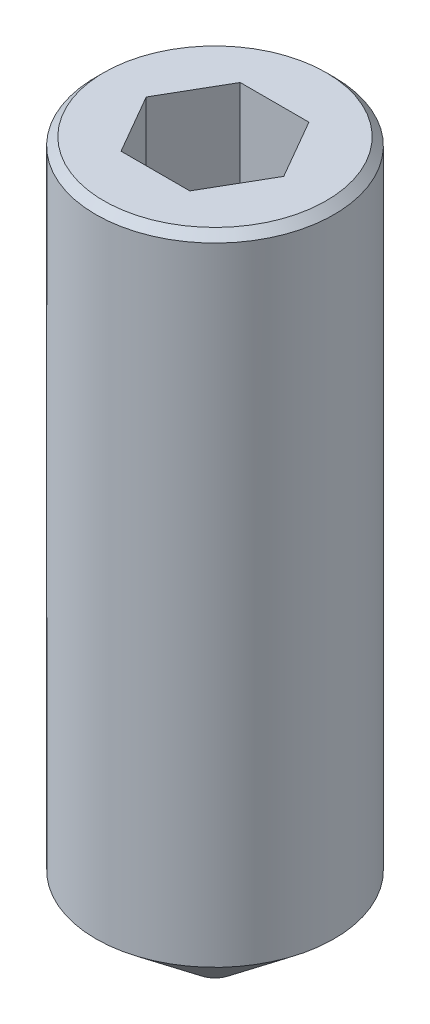
from build123d import *

# Parameters (mm, degrees)
CUT_EXTRUDE_1_DEPTH = 1.5
CHAMFER_1_SIZE      = 0.1


with BuildPart() as part:
    # 草图1 → 旋转1 (revolve)
    with BuildSketch(Plane.XY, mode=Mode.PRIVATE) as revolve_1_sk:
        Polygon((0, 0), (1.5, 0), (1.5, -8), (0.25, -9), (0, -9), align=None)
    revolve(revolve_1_sk.sketch.rotate(Axis((0, 8.713500289, 0), (0, -1, 0)), 90), axis=Axis((0, 8.713500289, 0), (0, -1, 0)))

    # 草图2 → 切除-拉伸1 (cut)
    with BuildSketch(Plane(origin=(0, 0, 0), x_dir=(1, 0, 0), z_dir=(0, 1, 0))):
        Polygon((-0.433012702, -0.75), (0.433012702, -0.75), (0.866025404, 0), (0.433012702, 0.75), (-0.433012702, 0.75), (-0.866025404, 0), align=None)
    extrude(amount=-CUT_EXTRUDE_1_DEPTH, mode=Mode.SUBTRACT)

    # 倒角1
    chamfer_1_edges = [part.edges().sort_by_distance(p)[0] for p in [
        (0, 0, -1.5),
    ]]
    chamfer(chamfer_1_edges, length=CHAMFER_1_SIZE)


solid = part.part
